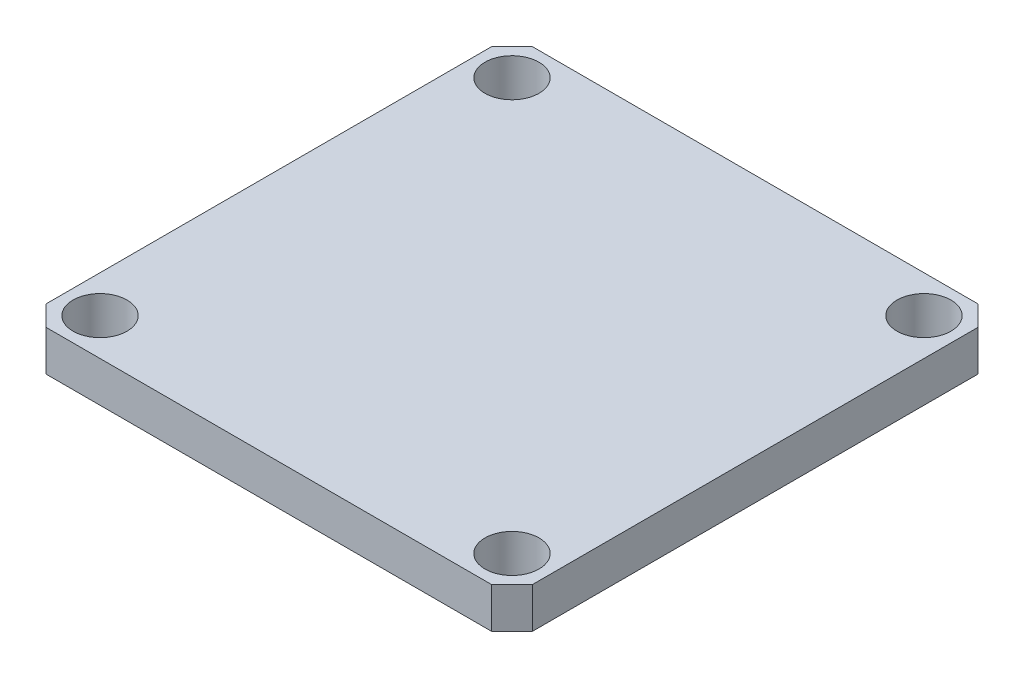
from build123d import *

# Parameters (mm, degrees)
SKETCH_1_R      = 2
EXTRUDE_1_DEPTH = 3


with BuildPart() as part:
    # 草图1 → 凸台-拉伸1 (new body)
    with BuildSketch(Plane(origin=(0, 0, 0), x_dir=(1, 0, 0), z_dir=(0, 1, 0))):
        Polygon((-16.5, -18), (16.5, -18), (18, -16.5), (18, 16.5), (16.5, 18), (-16.5, 18), (-18, 16.5), (-18, -16.5), align=None)
        with Locations(Location((15.25, 15.25, 0), (0, 0, 270))):
            Circle(SKETCH_1_R, mode=Mode.SUBTRACT)
        with Locations(Location((-15.25, 15.25, 0), (0, 0, 90))):
            Circle(SKETCH_1_R, mode=Mode.SUBTRACT)
        with Locations(Location((15.25, -15.25, 0), (0, 0, 90))):
            Circle(SKETCH_1_R, mode=Mode.SUBTRACT)
        with Locations(Location((-15.25, -15.25, 0), (0, 0, 270))):
            Circle(SKETCH_1_R, mode=Mode.SUBTRACT)
    extrude(amount=EXTRUDE_1_DEPTH)


solid = part.part
